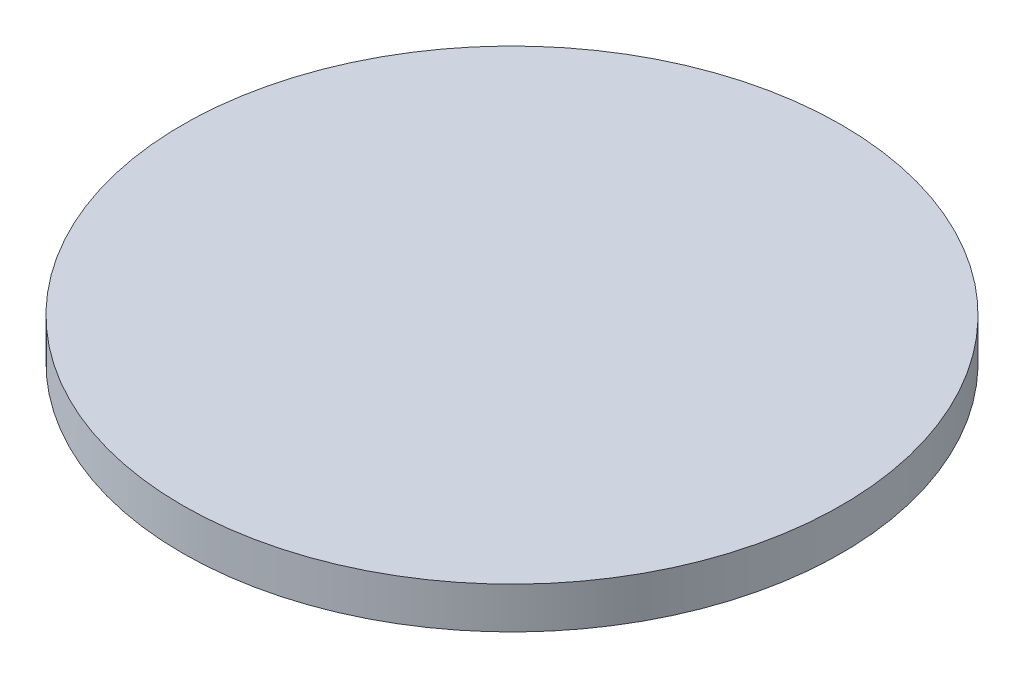
from build123d import *

# Parameters (mm, degrees)
SKETCH1_R           = 20.21761721
BOSS_EXTRUDE1_DEPTH = 2.54


with BuildPart() as part:
    # Sketch1 → Boss-Extrude1 (new body)
    with BuildSketch(Plane(origin=(0, 0, 0), x_dir=(1, 0, 0), z_dir=(0, 1, 0))):
        with Locations(Location((0, 0, 0), (0, 0, 270))):
            Circle(SKETCH1_R)
    extrude(amount=BOSS_EXTRUDE1_DEPTH)


solid = part.part
